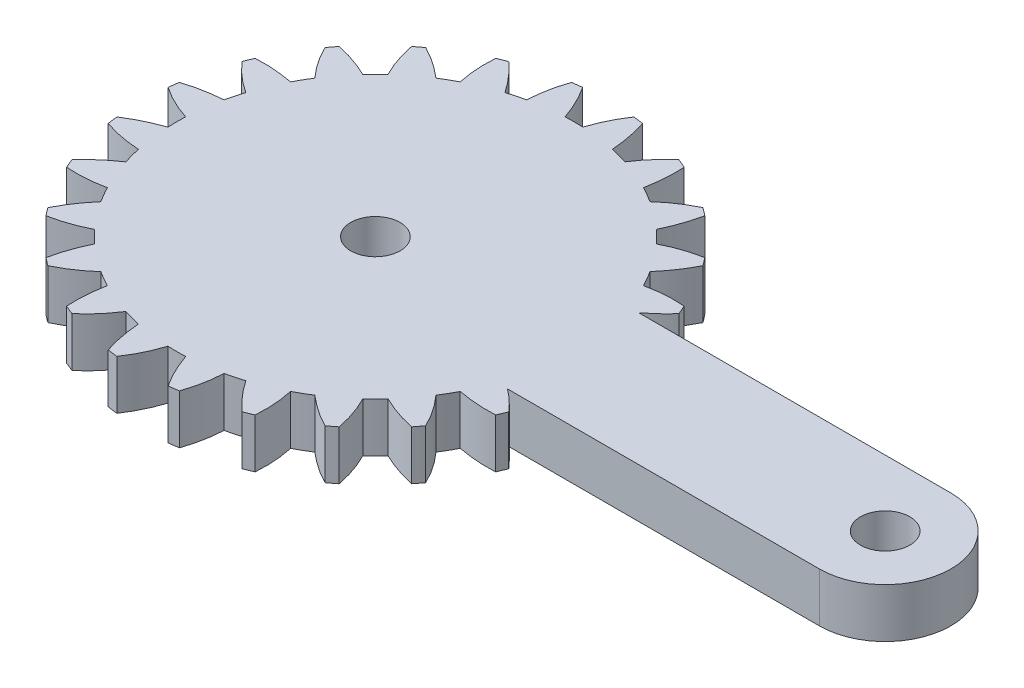
from build123d import *

# Parameters (mm, degrees)
SKETCH2_R           = 1.5
BOSS_EXTRUDE1_DEPTH = 3
L_EK1_SCALE         = 2


with BuildPart() as part:
    # Sketch2 → Boss-Extrude1 (new body)
    with BuildSketch(Plane(origin=(0, 0, 0), x_dir=(1, 0, 0), z_dir=(0, 1, 0))):
        with BuildLine():
            Line((31, 4.000000001), (12.012859152, 4.000000001))
            add(Edge.make_bspline(
                [(13.278985865, 5.170206419), (12.8954662, 4.733530556), (12.462190225, 4.344528056), (12.012859152, 4.000000001)],
                knots=[0.154712813, 0.154712813, 0.154712813, 0.154712813, 0.777489596, 0.777489596, 0.777489596, 0.777489596], degree=3))
            ThreePointArc((13.278985865, 5.170206419), (13.165283338, 5.453238911), (13.045548971, 5.733772933))
            add(Edge.make_bspline(
                [(10.729735914, 5.571433139), (11.468148216, 5.731782959), (12.25282672, 5.797378255), (13.045548971, 5.733772933)],
                knots=[0, 0, 0, 0, 0.84522739, 0.84522739, 0.84522739, 0.84522739], degree=3))
            ThreePointArc((10.729735914, 5.571433139), (10.602635836, 5.809665509), (10.470247132, 6.045))
            ThreePointArc((10.470247132, 6.045), (10.332600838, 6.277376835), (10.189798038, 6.506620931))
            add(Edge.make_bspline(
                [(11.488367505, 8.430890348), (11.138958904, 7.723663869), (10.678280228, 7.077546079), (10.189798038, 6.506620931)],
                knots=[0.154712813, 0.154712813, 0.154712813, 0.154712813, 1, 1, 1, 1], degree=3))
            ThreePointArc((11.488367505, 8.430890348), (11.305285099, 8.674850363), (11.117023034, 8.914835886))
            add(Edge.make_bspline(
                [(8.922136024, 8.158651162), (9.593885949, 8.504652361), (10.334849869, 8.771102293), (11.117023034, 8.914835886)],
                knots=[0, 0, 0, 0, 0.84522739, 0.84522739, 0.84522739, 0.84522739], degree=3))
            ThreePointArc((8.922136024, 8.158651162), (8.737707702, 8.35587004), (8.548920985, 8.548920985))
            ThreePointArc((8.548920985, 8.548920985), (8.355821324, 8.737754288), (8.158551674, 8.922226997))
            add(Edge.make_bspline(
                [(8.914835886, 11.117023034), (8.760376776, 10.343461111), (8.482622935, 9.600126837), (8.158551674, 8.922226997)],
                knots=[0.154712813, 0.154712813, 0.154712813, 0.154712813, 1, 1, 1, 1], degree=3))
            ThreePointArc((8.914835886, 11.117023034), (8.674850363, 11.305285099), (8.430890348, 11.488367505))
            add(Edge.make_bspline(
                [(6.506507308, 10.189870591), (7.065816209, 10.697943759), (7.71257008, 11.147090204), (8.430890348, 11.488367505)],
                knots=[0, 0, 0, 0, 0.84522739, 0.84522739, 0.84522739, 0.84522739], degree=3))
            ThreePointArc((6.506507308, 10.189870591), (6.277319227, 10.332635836), (6.045, 10.470247132))
            ThreePointArc((6.045, 10.470247132), (5.809606396, 10.602668227), (5.571313495, 10.729798038))
            add(Edge.make_bspline(
                [(5.733772933, 13.045548971), (5.784789448, 12.258368573), (5.708888907, 11.468474815), (5.571313495, 10.729798038)],
                knots=[0.154712813, 0.154712813, 0.154712813, 0.154712813, 1, 1, 1, 1], degree=3))
            ThreePointArc((5.733772933, 13.045548971), (5.453238911, 13.165283338), (5.170206419, 13.278985865))
            add(Edge.make_bspline(
                [(3.647470872, 11.526667178), (4.056222772, 12.16218797), (4.564691385, 12.76342234), (5.170206419, 13.278985865)],
                knots=[0, 0, 0, 0, 0.84522739, 0.84522739, 0.84522739, 0.84522739], degree=3))
            ThreePointArc((3.647470872, 11.526667178), (3.389141821, 11.605249576), (3.129122255, 11.67804324))
            ThreePointArc((3.129122255, 11.67804324), (2.867476392, 11.745027848), (2.604399509, 11.806151075))
            add(Edge.make_bspline(
                [(2.161962831, 14.085042304), (2.414978279, 13.337888473), (2.546103534, 12.555265188), (2.604399509, 11.806151075)],
                knots=[0.154712813, 0.154712813, 0.154712813, 0.154712813, 1, 1, 1, 1], degree=3))
            ThreePointArc((2.161962831, 14.085042304), (1.859998239, 14.128089275), (1.557181466, 14.164663282))
            add(Edge.make_bspline(
                [(0.539865323, 12.077940447), (0.770204456, 12.797599169), (1.105736515, 13.509948335), (1.557181466, 14.164663282)],
                knots=[0, 0, 0, 0, 0.84522739, 0.84522739, 0.84522739, 0.84522739], degree=3))
            ThreePointArc((0.539865323, 12.077940447), (0.27, 12.086984736), (0, 12.09))
            ThreePointArc((0, 12.09), (-0.270067389, 12.08698323), (-0.54, 12.077934426))
            add(Edge.make_bspline(
                [(-1.557181466, 14.164663282), (-1.119409669, 13.508453317), (-0.790194587, 12.786434986), (-0.54, 12.077934426)],
                knots=[0.154712813, 0.154712813, 0.154712813, 0.154712813, 1, 1, 1, 1], degree=3))
            ThreePointArc((-1.557181466, 14.164663282), (-1.859998239, 14.128089275), (-2.161962831, 14.085042304))
            add(Edge.make_bspline(
                [(-2.604531155, 11.806122033), (-2.568302021, 12.560875133), (-2.42857247, 13.335793678), (-2.161962831, 14.085042304)],
                knots=[0, 0, 0, 0, 0.84522739, 0.84522739, 0.84522739, 0.84522739], degree=3))
            ThreePointArc((-2.604531155, 11.806122033), (-2.867541874, 11.74501186), (-3.129122255, 11.67804324))
            ThreePointArc((-3.129122255, 11.67804324), (-3.389206524, 11.60523068), (-3.647599401, 11.526626506))
            add(Edge.make_bspline(
                [(-5.170206419, 13.278985865), (-4.577511698, 12.75843939), (-4.072642252, 12.146230371), (-3.647599401, 11.526626506)],
                knots=[0.154712813, 0.154712813, 0.154712813, 0.154712813, 1, 1, 1, 1], degree=3))
            ThreePointArc((-5.170206419, 13.278985865), (-5.453238911, 13.165283338), (-5.733772933, 13.045548971))
            add(Edge.make_bspline(
                [(-5.571433139, 10.729735914), (-5.731782959, 11.468148216), (-5.797378255, 12.25282672), (-5.733772933, 13.045548971)],
                knots=[0, 0, 0, 0, 0.84522739, 0.84522739, 0.84522739, 0.84522739], degree=3))
            ThreePointArc((-5.571433139, 10.729735914), (-5.809665509, 10.602635836), (-6.045, 10.470247132))
            ThreePointArc((-6.045, 10.470247132), (-6.277376835, 10.332600838), (-6.506620931, 10.189798038))
            add(Edge.make_bspline(
                [(-8.430890348, 11.488367505), (-7.723663869, 11.138958904), (-7.077546079, 10.678280228), (-6.506620931, 10.189798038)],
                knots=[0.154712813, 0.154712813, 0.154712813, 0.154712813, 1, 1, 1, 1], degree=3))
            ThreePointArc((-8.430890348, 11.488367505), (-8.674850363, 11.305285099), (-8.914835886, 11.117023034))
            add(Edge.make_bspline(
                [(-8.158651162, 8.922136024), (-8.504652361, 9.593885949), (-8.771102293, 10.334849869), (-8.914835886, 11.117023034)],
                knots=[0, 0, 0, 0, 0.84522739, 0.84522739, 0.84522739, 0.84522739], degree=3))
            ThreePointArc((-8.158651162, 8.922136024), (-8.35587004, 8.737707702), (-8.548920985, 8.548920985))
            ThreePointArc((-8.548920985, 8.548920985), (-8.737754288, 8.355821324), (-8.922226997, 8.158551674))
            add(Edge.make_bspline(
                [(-11.117023034, 8.914835886), (-10.343461111, 8.760376776), (-9.600126837, 8.482622935), (-8.922226997, 8.158551674)],
                knots=[0.154712813, 0.154712813, 0.154712813, 0.154712813, 1, 1, 1, 1], degree=3))
            ThreePointArc((-11.117023034, 8.914835886), (-11.305285099, 8.674850363), (-11.488367505, 8.430890348))
            add(Edge.make_bspline(
                [(-10.189870591, 6.506507308), (-10.697943759, 7.065816209), (-11.147090204, 7.71257008), (-11.488367505, 8.430890348)],
                knots=[0, 0, 0, 0, 0.84522739, 0.84522739, 0.84522739, 0.84522739], degree=3))
            ThreePointArc((-10.189870591, 6.506507308), (-10.332635836, 6.277319227), (-10.470247132, 6.045))
            ThreePointArc((-10.470247132, 6.045), (-10.602668227, 5.809606396), (-10.729798038, 5.571313495))
            add(Edge.make_bspline(
                [(-13.045548971, 5.733772933), (-12.258368573, 5.784789448), (-11.468474815, 5.708888907), (-10.729798038, 5.571313495)],
                knots=[0.154712813, 0.154712813, 0.154712813, 0.154712813, 1, 1, 1, 1], degree=3))
            ThreePointArc((-13.045548971, 5.733772933), (-13.165283338, 5.453238911), (-13.278985865, 5.170206419))
            add(Edge.make_bspline(
                [(-11.526667178, 3.647470872), (-12.16218797, 4.056222772), (-12.76342234, 4.564691385), (-13.278985865, 5.170206419)],
                knots=[0, 0, 0, 0, 0.84522739, 0.84522739, 0.84522739, 0.84522739], degree=3))
            ThreePointArc((-11.526667178, 3.647470872), (-11.605249576, 3.389141821), (-11.67804324, 3.129122255))
            ThreePointArc((-11.67804324, 3.129122255), (-11.745027848, 2.867476392), (-11.806151075, 2.604399509))
            add(Edge.make_bspline(
                [(-14.085042304, 2.161962831), (-13.337888473, 2.414978279), (-12.555265188, 2.546103534), (-11.806151075, 2.604399509)],
                knots=[0.154712813, 0.154712813, 0.154712813, 0.154712813, 1, 1, 1, 1], degree=3))
            ThreePointArc((-14.085042304, 2.161962831), (-14.128089275, 1.859998239), (-14.164663282, 1.557181466))
            add(Edge.make_bspline(
                [(-12.077940447, 0.539865323), (-12.797599169, 0.770204456), (-13.509948335, 1.105736515), (-14.164663282, 1.557181466)],
                knots=[0, 0, 0, 0, 0.84522739, 0.84522739, 0.84522739, 0.84522739], degree=3))
            ThreePointArc((-12.077940447, 0.539865323), (-12.086984736, 0.27), (-12.09, 0))
            ThreePointArc((-12.09, 0), (-12.08698323, -0.270067389), (-12.077934426, -0.54))
            add(Edge.make_bspline(
                [(-14.164663282, -1.557181466), (-13.508453317, -1.119409669), (-12.786434986, -0.790194587), (-12.077934426, -0.54)],
                knots=[0.154712813, 0.154712813, 0.154712813, 0.154712813, 1, 1, 1, 1], degree=3))
            ThreePointArc((-14.164663282, -1.557181466), (-14.128089275, -1.859998239), (-14.085042304, -2.161962831))
            add(Edge.make_bspline(
                [(-11.806122033, -2.604531155), (-12.560875133, -2.568302021), (-13.335793678, -2.42857247), (-14.085042304, -2.161962831)],
                knots=[0, 0, 0, 0, 0.84522739, 0.84522739, 0.84522739, 0.84522739], degree=3))
            ThreePointArc((-11.806122033, -2.604531155), (-11.74501186, -2.867541874), (-11.67804324, -3.129122255))
            ThreePointArc((-11.67804324, -3.129122255), (-11.60523068, -3.389206524), (-11.526626506, -3.647599401))
            add(Edge.make_bspline(
                [(-13.278985865, -5.170206419), (-12.75843939, -4.577511698), (-12.146230371, -4.072642252), (-11.526626506, -3.647599401)],
                knots=[0.154712813, 0.154712813, 0.154712813, 0.154712813, 1, 1, 1, 1], degree=3))
            ThreePointArc((-13.278985865, -5.170206419), (-13.165283338, -5.453238911), (-13.045548971, -5.733772933))
            add(Edge.make_bspline(
                [(-10.729735914, -5.571433139), (-11.468148216, -5.731782959), (-12.25282672, -5.797378255), (-13.045548971, -5.733772933)],
                knots=[0, 0, 0, 0, 0.84522739, 0.84522739, 0.84522739, 0.84522739], degree=3))
            ThreePointArc((-10.729735914, -5.571433139), (-10.602635836, -5.809665509), (-10.470247132, -6.045))
            ThreePointArc((-10.470247132, -6.045), (-10.332600838, -6.277376835), (-10.189798038, -6.506620931))
            add(Edge.make_bspline(
                [(-11.488367505, -8.430890348), (-11.138958904, -7.723663869), (-10.678280228, -7.077546079), (-10.189798038, -6.506620931)],
                knots=[0.154712813, 0.154712813, 0.154712813, 0.154712813, 1, 1, 1, 1], degree=3))
            ThreePointArc((-11.488367505, -8.430890348), (-11.305285099, -8.674850363), (-11.117023034, -8.914835886))
            add(Edge.make_bspline(
                [(-8.922136024, -8.158651162), (-9.593885949, -8.504652361), (-10.334849869, -8.771102293), (-11.117023034, -8.914835886)],
                knots=[0, 0, 0, 0, 0.84522739, 0.84522739, 0.84522739, 0.84522739], degree=3))
            ThreePointArc((-8.922136024, -8.158651162), (-8.737707702, -8.35587004), (-8.548920985, -8.548920985))
            ThreePointArc((-8.548920985, -8.548920985), (-8.355821324, -8.737754288), (-8.158551674, -8.922226997))
            add(Edge.make_bspline(
                [(-8.914835886, -11.117023034), (-8.760376776, -10.343461111), (-8.482622935, -9.600126837), (-8.158551674, -8.922226997)],
                knots=[0.154712813, 0.154712813, 0.154712813, 0.154712813, 1, 1, 1, 1], degree=3))
            ThreePointArc((-8.914835886, -11.117023034), (-8.674850363, -11.305285099), (-8.430890348, -11.488367505))
            add(Edge.make_bspline(
                [(-6.506507308, -10.189870591), (-7.065816209, -10.697943759), (-7.71257008, -11.147090204), (-8.430890348, -11.488367505)],
                knots=[0, 0, 0, 0, 0.84522739, 0.84522739, 0.84522739, 0.84522739], degree=3))
            ThreePointArc((-6.506507308, -10.189870591), (-6.277319227, -10.332635836), (-6.045, -10.470247132))
            ThreePointArc((-6.045, -10.470247132), (-5.809606396, -10.602668227), (-5.571313495, -10.729798038))
            add(Edge.make_bspline(
                [(-5.733772933, -13.045548971), (-5.784789448, -12.258368573), (-5.708888907, -11.468474815), (-5.571313495, -10.729798038)],
                knots=[0.154712813, 0.154712813, 0.154712813, 0.154712813, 1, 1, 1, 1], degree=3))
            ThreePointArc((-5.733772933, -13.045548971), (-5.453238911, -13.165283338), (-5.170206419, -13.278985865))
            add(Edge.make_bspline(
                [(-3.647470872, -11.526667178), (-4.056222772, -12.16218797), (-4.564691385, -12.76342234), (-5.170206419, -13.278985865)],
                knots=[0, 0, 0, 0, 0.84522739, 0.84522739, 0.84522739, 0.84522739], degree=3))
            ThreePointArc((-3.647470872, -11.526667178), (-3.389141821, -11.605249576), (-3.129122255, -11.67804324))
            ThreePointArc((-3.129122255, -11.67804324), (-2.867476392, -11.745027848), (-2.604399509, -11.806151075))
            add(Edge.make_bspline(
                [(-2.161962831, -14.085042304), (-2.414978279, -13.337888473), (-2.546103534, -12.555265188), (-2.604399509, -11.806151075)],
                knots=[0.154712813, 0.154712813, 0.154712813, 0.154712813, 1, 1, 1, 1], degree=3))
            ThreePointArc((-2.161962831, -14.085042304), (-1.859998239, -14.128089275), (-1.557181466, -14.164663282))
            add(Edge.make_bspline(
                [(-0.539865323, -12.077940447), (-0.770204456, -12.797599169), (-1.105736515, -13.509948335), (-1.557181466, -14.164663282)],
                knots=[0, 0, 0, 0, 0.84522739, 0.84522739, 0.84522739, 0.84522739], degree=3))
            ThreePointArc((-0.539865323, -12.077940447), (-0.27, -12.086984736), (0, -12.09))
            ThreePointArc((0, -12.09), (0.270067389, -12.08698323), (0.54, -12.077934426))
            add(Edge.make_bspline(
                [(1.557181466, -14.164663282), (1.119409669, -13.508453317), (0.790194587, -12.786434986), (0.54, -12.077934426)],
                knots=[0.154712813, 0.154712813, 0.154712813, 0.154712813, 1, 1, 1, 1], degree=3))
            ThreePointArc((1.557181466, -14.164663282), (1.859998239, -14.128089275), (2.161962831, -14.085042304))
            add(Edge.make_bspline(
                [(2.604531155, -11.806122033), (2.568302021, -12.560875133), (2.42857247, -13.335793678), (2.161962831, -14.085042304)],
                knots=[0, 0, 0, 0, 0.84522739, 0.84522739, 0.84522739, 0.84522739], degree=3))
            ThreePointArc((2.604531155, -11.806122033), (2.867541874, -11.74501186), (3.129122255, -11.67804324))
            ThreePointArc((3.129122255, -11.67804324), (3.389206524, -11.60523068), (3.647599401, -11.526626506))
            add(Edge.make_bspline(
                [(5.170206419, -13.278985865), (4.577511698, -12.75843939), (4.072642252, -12.146230371), (3.647599401, -11.526626506)],
                knots=[0.154712813, 0.154712813, 0.154712813, 0.154712813, 1, 1, 1, 1], degree=3))
            ThreePointArc((5.170206419, -13.278985865), (5.453238911, -13.165283338), (5.733772933, -13.045548971))
            add(Edge.make_bspline(
                [(5.571433139, -10.729735914), (5.731782959, -11.468148216), (5.797378255, -12.25282672), (5.733772933, -13.045548971)],
                knots=[0, 0, 0, 0, 0.84522739, 0.84522739, 0.84522739, 0.84522739], degree=3))
            ThreePointArc((5.571433139, -10.729735914), (5.809665509, -10.602635836), (6.045, -10.470247132))
            ThreePointArc((6.045, -10.470247132), (6.277376835, -10.332600838), (6.506620931, -10.189798038))
            add(Edge.make_bspline(
                [(8.430890348, -11.488367505), (7.723663869, -11.138958904), (7.077546079, -10.678280228), (6.506620931, -10.189798038)],
                knots=[0.154712813, 0.154712813, 0.154712813, 0.154712813, 1, 1, 1, 1], degree=3))
            ThreePointArc((8.430890348, -11.488367505), (8.674850363, -11.305285099), (8.914835886, -11.117023034))
            add(Edge.make_bspline(
                [(8.158651162, -8.922136024), (8.504652361, -9.593885949), (8.771102293, -10.334849869), (8.914835886, -11.117023034)],
                knots=[0, 0, 0, 0, 0.84522739, 0.84522739, 0.84522739, 0.84522739], degree=3))
            ThreePointArc((8.158651162, -8.922136024), (8.35587004, -8.737707702), (8.548920985, -8.548920985))
            ThreePointArc((8.548920985, -8.548920985), (8.737754288, -8.355821324), (8.922226997, -8.158551674))
            add(Edge.make_bspline(
                [(11.117023034, -8.914835886), (10.343461111, -8.760376776), (9.600126837, -8.482622935), (8.922226997, -8.158551674)],
                knots=[0.154712813, 0.154712813, 0.154712813, 0.154712813, 1, 1, 1, 1], degree=3))
            ThreePointArc((11.117023034, -8.914835886), (11.305285099, -8.674850363), (11.488367505, -8.430890348))
            add(Edge.make_bspline(
                [(10.189870591, -6.506507308), (10.697943759, -7.065816209), (11.147090204, -7.71257008), (11.488367505, -8.430890348)],
                knots=[0, 0, 0, 0, 0.84522739, 0.84522739, 0.84522739, 0.84522739], degree=3))
            ThreePointArc((10.189870591, -6.506507308), (10.332635836, -6.277319227), (10.470247132, -6.045))
            ThreePointArc((10.470247132, -6.045), (10.602668227, -5.809606396), (10.729798038, -5.571313495))
            add(Edge.make_bspline(
                [(13.045548971, -5.733772933), (12.258368573, -5.784789448), (11.468474815, -5.708888907), (10.729798038, -5.571313495)],
                knots=[0.154712813, 0.154712813, 0.154712813, 0.154712813, 1, 1, 1, 1], degree=3))
            ThreePointArc((13.045548971, -5.733772933), (13.165283338, -5.453238911), (13.278985865, -5.170206419))
            add(Edge.make_bspline(
                [(12.032510858, -3.999999999), (12.480346232, -4.337627374), (12.902507267, -4.728042767), (13.278985865, -5.170206419)],
                knots=[0.228019214, 0.228019214, 0.228019214, 0.228019214, 0.84522739, 0.84522739, 0.84522739, 0.84522739], degree=3))
            Line((12.032510858, -3.999999999), (31, -3.999999999))
            ThreePointArc((31, -3.999999999), (35, 1e-09), (31, 4.000000001))
        make_face()
        with Locations(Location((31, 1e-09, 0), (0, 0, 270))):
            Circle(SKETCH2_R, mode=Mode.SUBTRACT)
        with Locations(Location((0, 0, 0), (0, 0, 270))):
            Circle(SKETCH2_R, mode=Mode.SUBTRACT)
    extrude(amount=BOSS_EXTRUDE1_DEPTH)


with BuildPart() as part_1:
    # Ölçek1: scaled about (5.488849997, 1.5, 2.1149e-05)
    add(part.part.scale(L_EK1_SCALE).moved(Location((-5.488849997, -1.5, -2.1149e-05))))


solid = part_1.part
